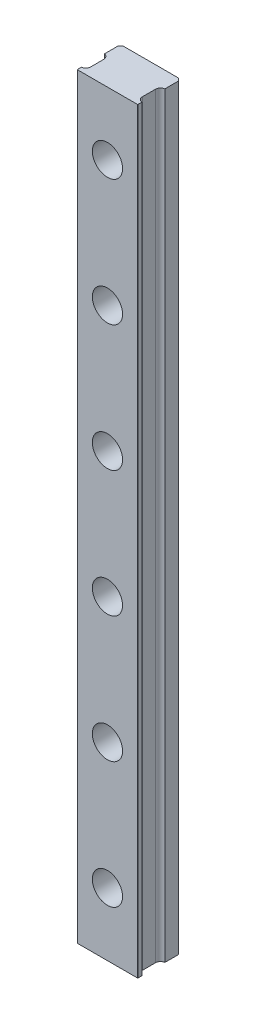
from build123d import *

# Parameters (mm, degrees)
CROQUIS1_W                                           = 12
CROQUIS1_H                                           = 150
SALIENTE_EXTRUIR1_DEPTH                              = 8.6
CORTAR_EXTRUIR1_DEPTH                                = 151.366086602
CORTAR_EXTRUIR2_DEPTH                                = 151.366086602
REFRENTADO_PARA_TORNILLO_CON_CABEZA_HEXA_D           = 3.4
REFRENTADO_PARA_TORNILLO_CON_CABEZA_HEXA_CBORE_D     = 6
REFRENTADO_PARA_TORNILLO_CON_CABEZA_HEXA_CBORE_DEPTH = 5.6
CHAFL_N1_SIZE                                        = 0.05
CHAFL_N2_SIZE                                        = 0.5


with BuildPart() as part:
    # Croquis1 → Saliente-Extruir1 (new body)
    with BuildSketch(Plane(origin=(0, 0, 0), x_dir=(-1, 0, 0), z_dir=(0, 0, -1))):
        with Locations((0, 75)):
            Rectangle(CROQUIS1_W, CROQUIS1_H)
    extrude(amount=-SALIENTE_EXTRUIR1_DEPTH)

    # Croquis2 → Cortar-Extruir1 (cut, through all)
    with BuildSketch(Plane.XZ):
        with BuildLine():
            Line((-6, 7.79215674), (-6, 3.20784326))
            ThreePointArc((-6, 3.20784326), (-5.375, 3.538562175), (-5.125, 4.200000003))
            Line((-5.125, 4.200000003), (-5.125, 6.800000001))
            ThreePointArc((-5.125, 6.800000001), (-5.375, 7.461437828), (-6, 7.79215674))
        make_face()
    extrude(amount=-CORTAR_EXTRUIR1_DEPTH, mode=Mode.SUBTRACT)

    # Croquis3 → Cortar-Extruir2 (cut, through all)
    with BuildSketch(Plane.XZ):
        with BuildLine():
            Line((6, 3.20784326), (6, 7.79215674))
            ThreePointArc((6, 7.79215674), (5.375, 7.461437825), (5.125, 6.799999997))
            Line((5.125, 6.799999997), (5.125, 4.199999999))
            ThreePointArc((5.125, 4.199999999), (5.375, 3.538562172), (6, 3.20784326))
        make_face()
    extrude(amount=-CORTAR_EXTRUIR2_DEPTH, mode=Mode.SUBTRACT)

    # Refrentado para tornillo con cabeza hexagonal de M31 (through all)
    with Locations(Plane.XY.offset(8.6)):
        with Locations((0, 137.5), (0, 112.5), (0, 87.5), (0, 62.5), (0, 37.5), (0, 12.5)):
            CounterBoreHole(REFRENTADO_PARA_TORNILLO_CON_CABEZA_HEXA_D / 2, REFRENTADO_PARA_TORNILLO_CON_CABEZA_HEXA_CBORE_D / 2, REFRENTADO_PARA_TORNILLO_CON_CABEZA_HEXA_CBORE_DEPTH)

    # Chaflán1
    chafl_n1_edges = [part.edges().sort_by_distance(p)[0] for p in [
        (-6, 75, 8.6),
        (6, 75, 8.6),
    ]]
    chamfer(chafl_n1_edges, length=CHAFL_N1_SIZE)

    # Chaflán2
    chafl_n2_edges = [part.edges().sort_by_distance(p)[0] for p in [
        (-6, 75, 0),
        (6, 75, 0),
    ]]
    chamfer(chafl_n2_edges, length=CHAFL_N2_SIZE)


solid = part.part
